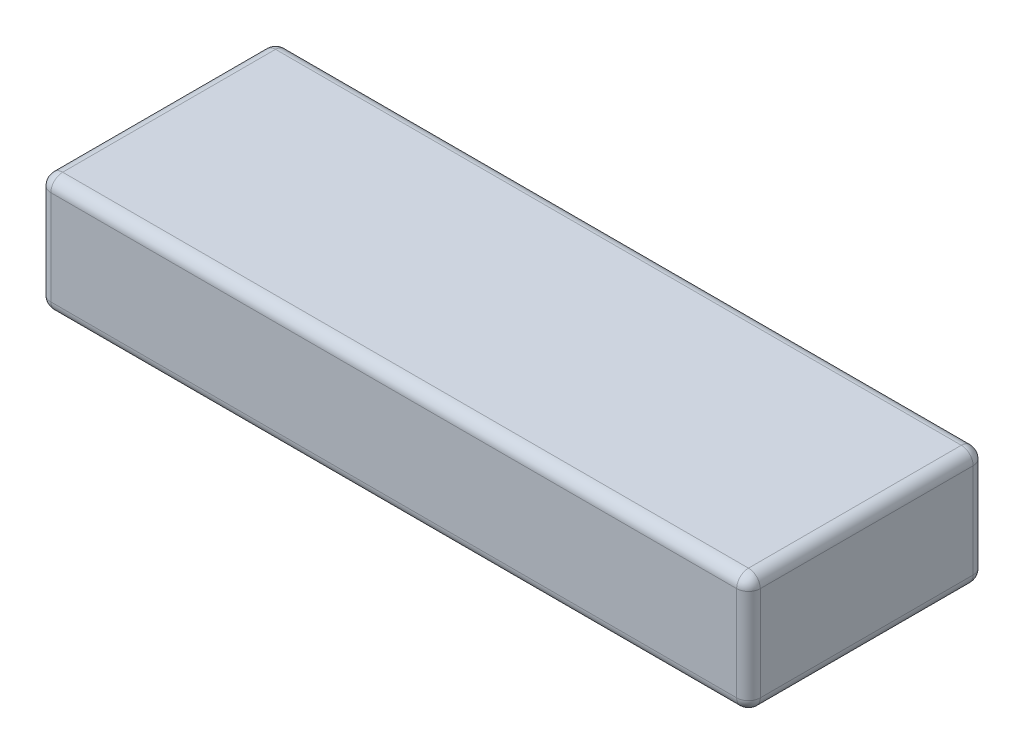
from build123d import *

# Parameters (mm, degrees)
SKETCH1_W           = 60
SKETCH1_H           = 20
BOSS_EXTRUDE1_DEPTH = 5
FILLET1_R           = 1


with BuildPart() as part:
    # Sketch1 → Boss-Extrude1 (new, symmetric)
    with BuildSketch(Plane(origin=(0, 0, 0), x_dir=(1, 0, 0), z_dir=(0, 1, 0))):
        Rectangle(SKETCH1_W, SKETCH1_H)
    extrude(amount=BOSS_EXTRUDE1_DEPTH, both=True)

    # Fillet1
    fillet1_edges = [part.edges().sort_by_distance(p)[0] for p in [
        (-30, 5, 0),
        (0, 5, 10),
        (30, 5, 0),
        (0, -5, 10),
        (-30, -5, 0),
        (0, -5, -10),
        (30, -5, 0),
        (30, 0, 10),
        (-30, 0, 10),
        (-30, 0, -10),
        (30, 0, -10),
        (0, 5, -10),
    ]]
    fillet(fillet1_edges, radius=FILLET1_R)


solid = part.part
